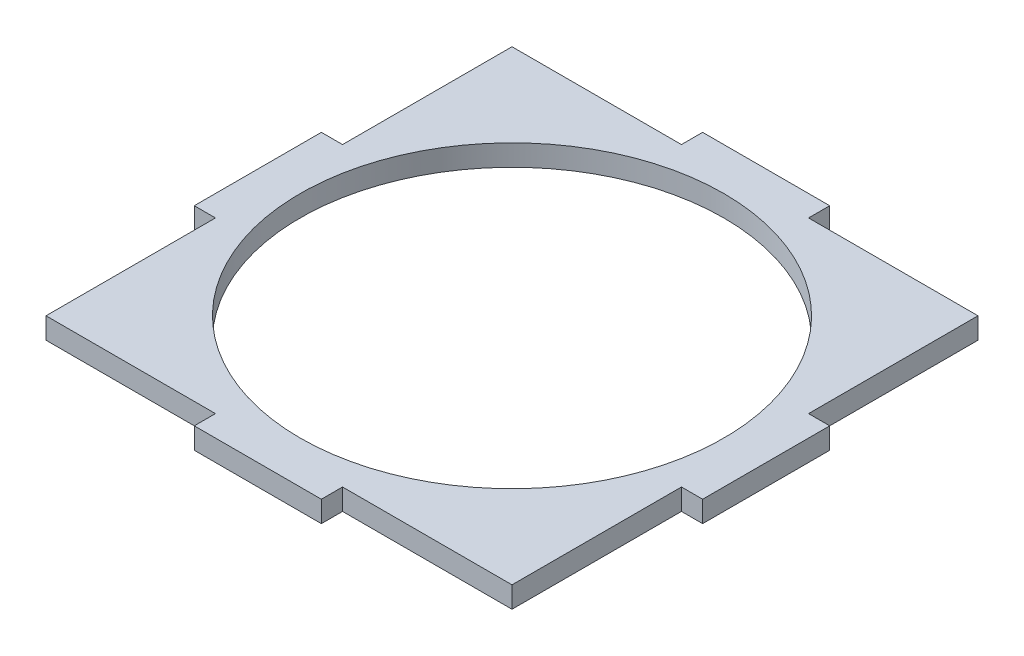
from build123d import *

# Parameters (mm, degrees)
SKETCH2_W           = 139.7
SKETCH2_H           = 139.7
SKETCH2_R           = 63.5
BOSS_EXTRUDE2_DEPTH = 6.35
SKETCH2_4_W         = 38.1
SKETCH2_4_H         = 6.35
SKETCH2_4_W_2       = 6.35
SKETCH2_4_H_2       = 38.1
BOSS_EXTRUDE3_DEPTH = 6.35


with BuildPart() as part:
    # Sketch2 → Boss-Extrude2 (new body)
    with BuildSketch(Plane(origin=(0, 0, 0), x_dir=(1, 0, 0), z_dir=(0, 1, 0))):
        Rectangle(SKETCH2_W, SKETCH2_H)
        Circle(SKETCH2_R, mode=Mode.SUBTRACT)
    extrude(amount=BOSS_EXTRUDE2_DEPTH)

    # Sketch2<4> → Boss-Extrude3 (add)
    with BuildSketch(Plane(origin=(0, 0, 0), x_dir=(1, 0, 0), z_dir=(0, 1, 0))):
        with Locations((0, -73.025)):
            Rectangle(SKETCH2_4_W, SKETCH2_4_H)
        with Locations((-73.025, 0)):
            Rectangle(SKETCH2_4_W_2, SKETCH2_4_H_2)
        with Locations((73.025, 0)):
            Rectangle(SKETCH2_4_W_2, SKETCH2_4_H_2)
        with Locations((0, 73.025)):
            Rectangle(SKETCH2_4_W, SKETCH2_4_H)
    extrude(amount=BOSS_EXTRUDE3_DEPTH)


solid = part.part
